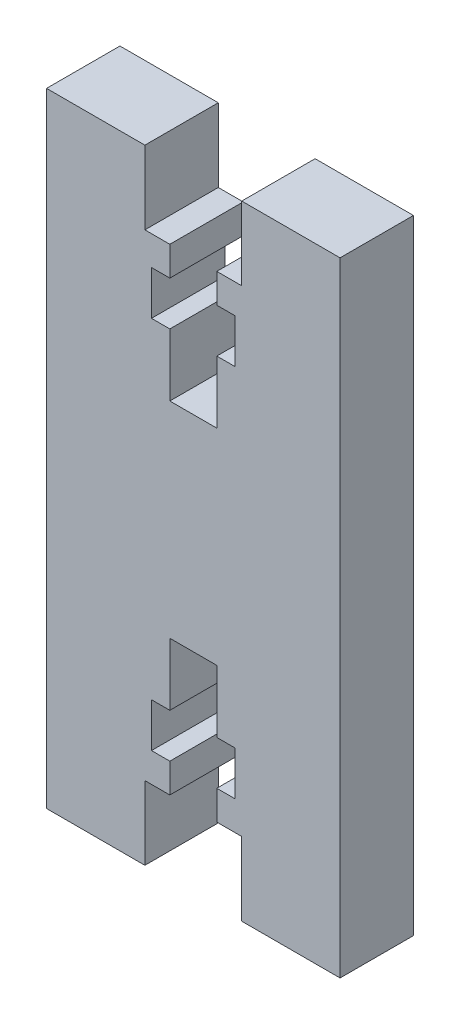
from build123d import *

# Parameters (mm, degrees)
BOSS_EXTRU_1_DEPTH = 5


with BuildPart() as part:
    # Esquisse1 → Boss.-Extru.1 (new body)
    with BuildSketch(Plane.XY):
        Polygon((-12.911051911, 37.825067336), (-12.911051911, -4.674932664), (-6.211051911, -4.674932664), (-6.211051911, 0.325067336), (-4.511051911, 0.325067336), (-4.511051911, 2.321763371), (-5.761051911, 2.321763371), (-5.761051911, 5.321763371), (-4.511051911, 5.321763371), (-4.511051911, 9.575067336), (-1.311051911, 9.575067336), (-1.311051911, 5.321763371), (-0.061051911, 5.321763371), (-0.061051911, 2.321763371), (-1.311051911, 2.321763371), (-1.311051911, 0.325067336), (0.388948089, 0.325067336), (0.388948089, -4.674932664), (7.088948089, -4.674932664), (7.088948089, 37.825067336), (0.388948089, 37.825067336), (0.388948089, 32.825067336), (-1.311051911, 32.825067336), (-1.311051911, 30.828371301), (-0.061051911, 30.828371301), (-0.061051911, 27.828371301), (-1.311051911, 27.828371301), (-1.311051911, 23.575067336), (-4.511051911, 23.575067336), (-4.511051911, 27.828371301), (-5.761051911, 27.828371301), (-5.761051911, 30.828371301), (-4.511051911, 30.828371301), (-4.511051911, 32.825067336), (-6.211051911, 32.825067336), (-6.211051911, 37.825067336), align=None)
    extrude(amount=BOSS_EXTRU_1_DEPTH)


solid = part.part
